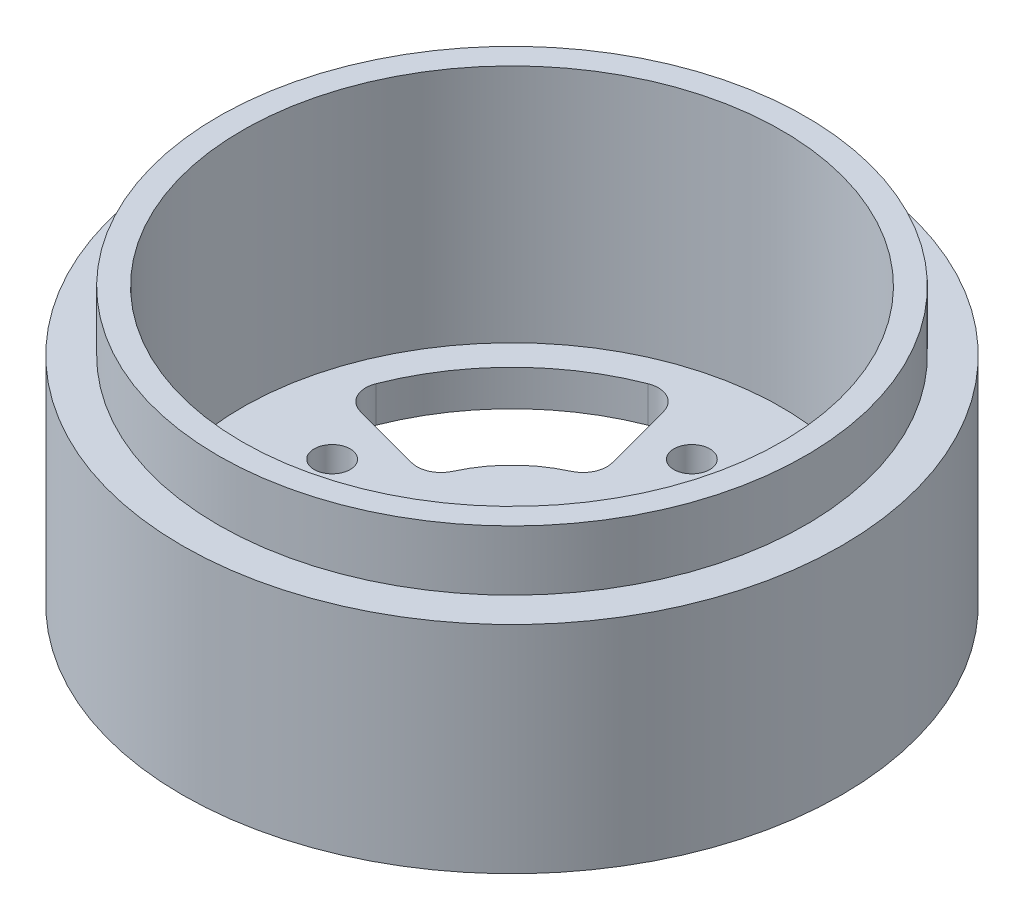
from build123d import *

# Parameters (mm, degrees)
SKETCH1_R           = 27.5
BOSS_EXTRUDE1_DEPTH = 3
SKETCH2_R           = 27.5
SKETCH2_R_2         = 24.5
BOSS_EXTRUDE2_DEPTH = 15
SKETCH4_R           = 4
CUT_EXTRUDE1_DEPTH  = 5
SKETCH5_R           = 1.5
CUT_EXTRUDE2_DEPTH  = 10
FILLET1_R           = 2
SKETCH6_R           = 24.5
SKETCH6_R_2         = 22.5
BOSS_EXTRUDE3_DEPTH = 20


with BuildPart() as part:
    # Sketch1 → Boss-Extrude1 (new body)
    with BuildSketch(Plane(origin=(0, 0, 0), x_dir=(1, 0, 0), z_dir=(0, 1, 0))):
        Circle(SKETCH1_R)
    extrude(amount=BOSS_EXTRUDE1_DEPTH)

    # Sketch2 → Boss-Extrude2 (add)
    with BuildSketch(Plane(origin=(0, 3, 0), x_dir=(1, 0, 0), z_dir=(0, 1, 0))):
        Circle(SKETCH2_R)
        Circle(SKETCH2_R_2, mode=Mode.SUBTRACT)
    extrude(amount=BOSS_EXTRUDE2_DEPTH)

    # Sketch4 → Cut-Extrude1 (cut)
    with BuildSketch(Plane(origin=(0, 3, 0), x_dir=(1, 0, 0), z_dir=(0, 1, 0))):
        Circle(SKETCH4_R)
    extrude(amount=-CUT_EXTRUDE1_DEPTH, mode=Mode.SUBTRACT)

    # Sketch5 → Cut-Extrude2 (cut)
    with BuildSketch(Plane(origin=(0, 3, 0), x_dir=(1, 0, 0), z_dir=(0, 1, 0))):
        with BuildLine():
            Line((-2.588190451, 9.659258263), (-5.176380902, 19.318516526))
            ThreePointArc((-5.176380902, 19.318516526), (-14.142135624, 14.142135624), (-19.318516526, 5.176380902))
            Line((-19.318516526, 5.176380902), (-9.659258263, 2.588190451))
            ThreePointArc((-9.659258263, 2.588190451), (-7.071067812, 7.071067812), (-2.588190451, 9.659258263))
        make_face()
        with BuildLine():
            ThreePointArc((19.318516526, 5.176380902), (14.142135624, 14.142135624), (5.176380902, 19.318516526))
            Line((5.176380902, 19.318516526), (2.588190451, 9.659258263))
            ThreePointArc((2.588190451, 9.659258263), (7.071067812, 7.071067812), (9.659258263, 2.588190451))
            Line((9.659258263, 2.588190451), (19.318516526, 5.176380902))
        make_face()
        with BuildLine():
            Line((-9.659258263, -2.588190451), (-19.318516526, -5.176380902))
            ThreePointArc((-19.318516526, -5.176380902), (-14.142135624, -14.142135624), (-5.176380902, -19.318516526))
            Line((-5.176380902, -19.318516526), (-2.588190451, -9.659258263))
            ThreePointArc((-2.588190451, -9.659258263), (-7.071067812, -7.071067812), (-9.659258263, -2.588190451))
        make_face()
        with BuildLine():
            ThreePointArc((5.176380902, -19.318516526), (14.142135624, -14.142135624), (19.318516526, -5.176380902))
            Line((19.318516526, -5.176380902), (9.659258263, -2.588190451))
            ThreePointArc((9.659258263, -2.588190451), (7.071067812, -7.071067812), (2.588190451, -9.659258263))
            Line((2.588190451, -9.659258263), (5.176380902, -19.318516526))
        make_face()
        with Locations((0, 15)):
            Circle(SKETCH5_R)
        with Locations((15, 0)):
            Circle(SKETCH5_R)
        with Locations((0, -15)):
            Circle(SKETCH5_R)
        with Locations((-15, 0)):
            Circle(SKETCH5_R)
    extrude(amount=-CUT_EXTRUDE2_DEPTH, mode=Mode.SUBTRACT)

    # Fillet1
    fillet1_edges = [part.edges().sort_by_distance(p)[0] for p in [
        (-2.588190451, 1.5, -9.659258263),
        (-9.659258263, 1.5, -2.588190451),
        (-9.659258263, 1.5, 2.588190451),
        (-2.588190451, 1.5, 9.659258263),
        (2.588190451, 1.5, 9.659258263),
        (9.659258263, 1.5, 2.588190451),
        (2.588190451, 1.5, -9.659258263),
        (9.659258263, 1.5, -2.588190451),
        (19.318516526, 1.5, -5.176380902),
        (5.176380902, 1.5, -19.318516526),
        (19.318516526, 1.5, 5.176380902),
        (5.176380902, 1.5, 19.318516526),
        (-5.176380902, 1.5, 19.318516526),
        (-19.318516526, 1.5, 5.176380902),
        (-5.176380902, 1.5, -19.318516526),
        (-19.318516526, 1.5, -5.176380902),
    ]]
    fillet(fillet1_edges, radius=FILLET1_R)

    # Sketch6 → Boss-Extrude3 (add)
    with BuildSketch(Plane(origin=(0, 3, 0), x_dir=(1, 0, 0), z_dir=(0, 1, 0))):
        Circle(SKETCH6_R)
        Circle(SKETCH6_R_2, mode=Mode.SUBTRACT)
    extrude(amount=BOSS_EXTRUDE3_DEPTH)


solid = part.part
